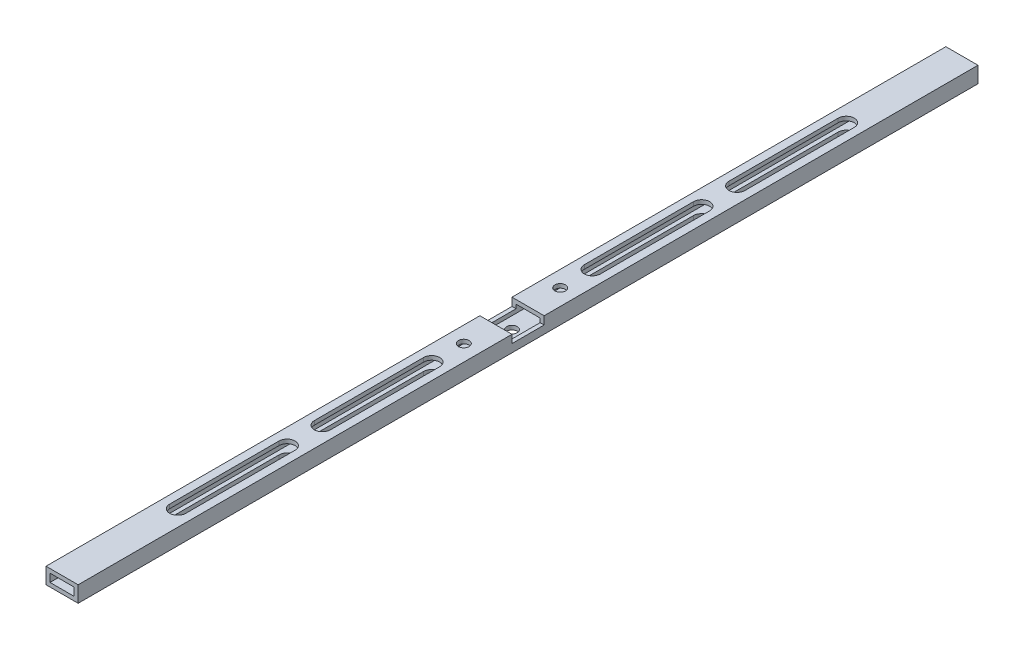
from build123d import *

# Parameters (mm, degrees)
SKETCH1_W            = 12.7
SKETCH1_H            = 6.35
SKETCH1_W_2          = 9.525
SKETCH1_H_2          = 3.175
BOSS_EXTRUDE1_DEPTH  = 355.6
CUT_EXTRUDE1_DEPTH   = 25.4
LPATTERN1_COUNT      = 2
LPATTERN1_PITCH      = 57.15
MIRROR1_COPY_1_DEPTH = 25.4
SKETCH3_W            = 12.7
SKETCH3_H            = 3.175
CUT_EXTRUDE2_DEPTH   = 25.4
SKETCH4_R            = 2.0955
CUT_EXTRUDE3_DEPTH   = 25.4


with BuildPart() as part:
    # Sketch1 → Boss-Extrude1 (new body)
    with BuildSketch(Plane.XY):
        Rectangle(SKETCH1_W, SKETCH1_H)
        Rectangle(SKETCH1_W_2, SKETCH1_H_2, mode=Mode.SUBTRACT)
    extrude(amount=BOSS_EXTRUDE1_DEPTH)

    # Sketch2 → Cut-Extrude1 (cut)
    with BuildSketch(Plane(origin=(0, 3.175, 0), x_dir=(1, 0, 0), z_dir=(0, 1, 0))):
        with BuildLine():
            Line((-3.175, -209.55), (-3.175, -252.73))
            ThreePointArc((-3.175, -252.73), (0, -255.905), (3.175, -252.73))
            Line((3.175, -252.73), (3.175, -209.55))
            ThreePointArc((3.175, -209.55), (0, -206.375), (-3.175, -209.55))
        make_face()
    cut_extrude1 = extrude(amount=-CUT_EXTRUDE1_DEPTH, mode=Mode.SUBTRACT)

    # LPattern1: Cut-Extrude1 ×2
    with Locations(*[(0, 0, i * LPATTERN1_PITCH) for i in range(1, LPATTERN1_COUNT)]):
        add(cut_extrude1, mode=Mode.SUBTRACT)

    # Mirror1: Cut-Extrude1 across plane
    add(cut_extrude1.mirror(Plane.XY.offset(177.8)), mode=Mode.SUBTRACT)

    # Mirror1 copy 1 sketch → Mirror1 copy 1 (cut)
    with BuildSketch(Plane(origin=(0, 3.175, 298.45), x_dir=(1, 0, 0), z_dir=(0, 1, 0))):
        with BuildLine():
            Line((-3.175, 209.55), (-3.175, 252.73))
            ThreePointArc((-3.175, 252.73), (0, 255.905), (3.175, 252.73))
            Line((3.175, 252.73), (3.175, 209.55))
            ThreePointArc((3.175, 209.55), (0, 206.375), (-3.175, 209.55))
        make_face()
    extrude(amount=-MIRROR1_COPY_1_DEPTH, mode=Mode.SUBTRACT)

    # Sketch3 → Cut-Extrude2 (cut)
    with BuildSketch(Plane(origin=(6.35, 0, 0), x_dir=(0, 0, -1), z_dir=(1, 0, 0))):
        with Locations((-177.8, 1.5875)):
            Rectangle(SKETCH3_W, SKETCH3_H)
    extrude(amount=-CUT_EXTRUDE2_DEPTH, mode=Mode.SUBTRACT)

    # Sketch4 → Cut-Extrude3 (cut)
    with BuildSketch(Plane(origin=(0, -3.175, 0), x_dir=(-1, 0, 0), z_dir=(0, -1, 0))):
        with Locations(Location((0, -177.8, 0), (0, 0, 90))):
            Circle(SKETCH4_R)
        with Locations(Location((0, -196.85, 0), (0, 0, 90))):
            Circle(SKETCH4_R)
        with Locations(Location((0, -158.75, 0), (0, 0, 270))):
            Circle(SKETCH4_R)
    extrude(amount=-CUT_EXTRUDE3_DEPTH, mode=Mode.SUBTRACT)


solid = part.part
